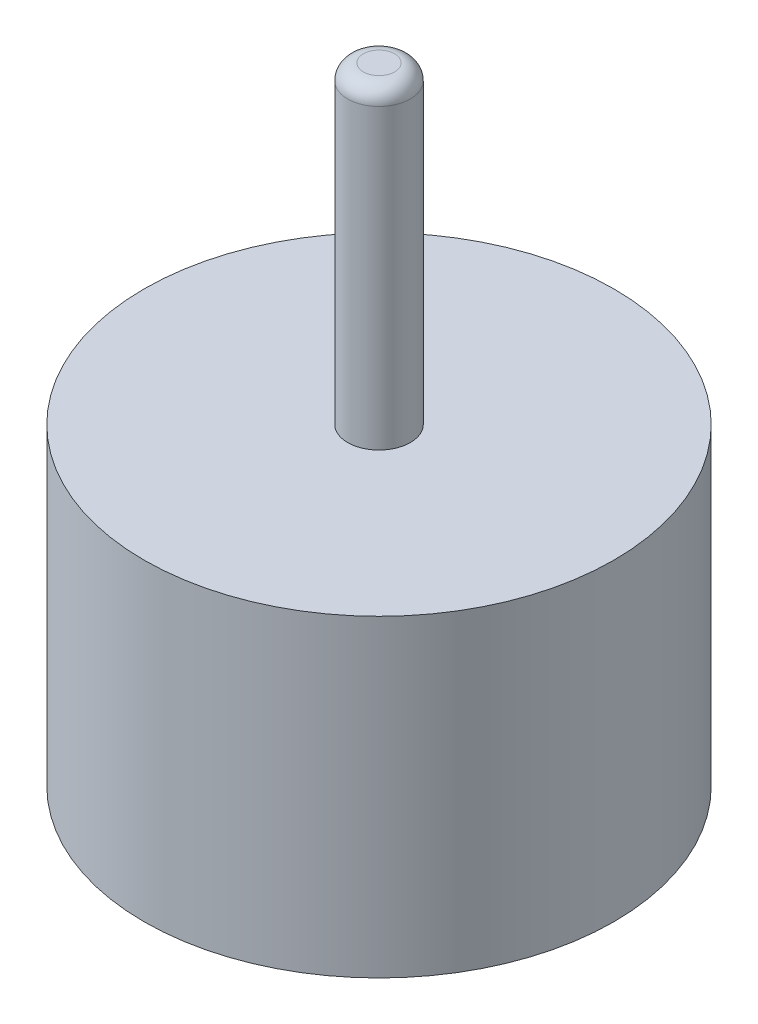
from build123d import *

# Parameters (mm, degrees)
SKETCH_1_R      = 75
EXTRUDE_1_DEPTH = 100
SKETCH_2_R      = 10
EXTRUDE_2_DEPTH = 100
FILLET_1_R      = 5


with BuildPart() as part:
    # 草图1 → 凸台-拉伸1 (new body)
    with BuildSketch(Plane(origin=(0, 0, 0), x_dir=(1, 0, 0), z_dir=(0, 1, 0))):
        with Locations(Location((0, 0, 0), (0, 0, 270))):
            Circle(SKETCH_1_R)
    extrude(amount=EXTRUDE_1_DEPTH)

    # 草图2 → 凸台-拉伸2 (add)
    with BuildSketch(Plane(origin=(0, 100, 0), x_dir=(1, 0, 0), z_dir=(0, 1, 0))):
        with Locations(Location((0, 0, 0), (0, 0, 270))):
            Circle(SKETCH_2_R)
    extrude(amount=EXTRUDE_2_DEPTH)

    # 圆角1
    fillet_1_edges = [part.edges().sort_by_distance(p)[0] for p in [
        (0, 200, -10),
    ]]
    fillet(fillet_1_edges, radius=FILLET_1_R)


solid = part.part
